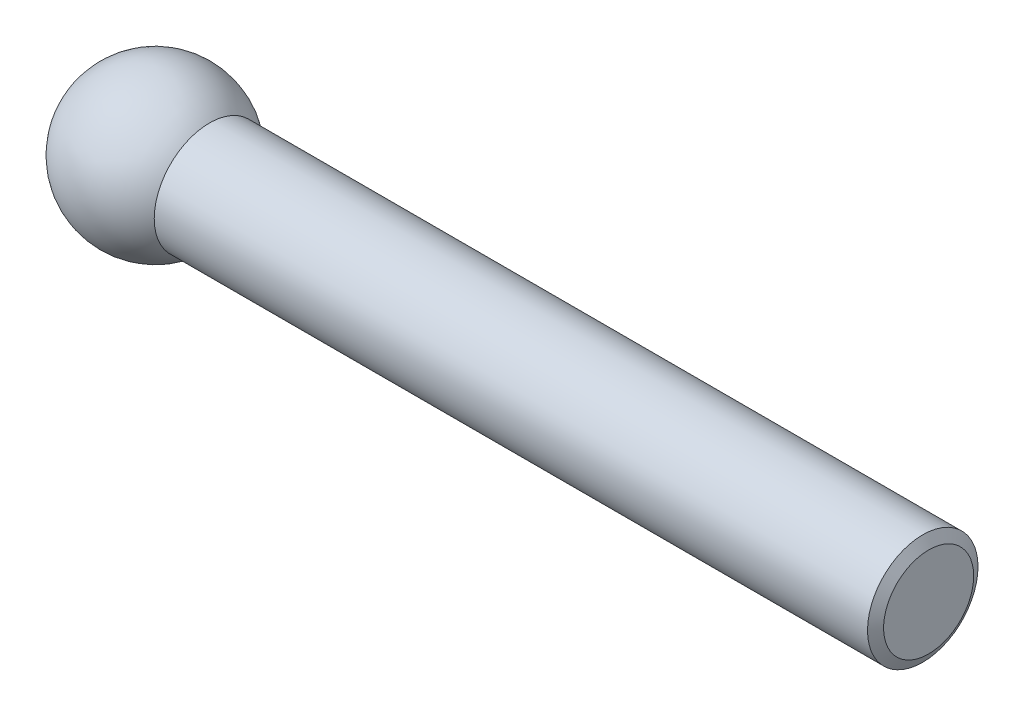
from build123d import *

# Parameters (mm, degrees)
SKETCH1_R           = 14.2875
BOSS_EXTRUDE1_DEPTH = 200
CHAMFER1_SIZE       = 1.524
CHAMFER1_SIZE2      = 2.639645431


with BuildPart() as part:
    # Sketch1 → Boss-Extrude1 (new body)
    with BuildSketch(Plane(origin=(0, 0, 0), x_dir=(0, 0, -1), z_dir=(1, 0, 0))):
        Circle(SKETCH1_R)
    extrude(amount=BOSS_EXTRUDE1_DEPTH)

    # Chamfer1
    chamfer1_edges = [part.edges().sort_by_distance(p)[0] for p in [
        (200, 0, 14.2875),
    ]]
    chamfer1_side = [part.faces().sort_by_distance(p)[0] for p in [
        (100, 0, 14.2875),
    ]]
    chamfer(chamfer1_edges, length=CHAMFER1_SIZE, length2=CHAMFER1_SIZE2, reference=chamfer1_side[0])

    # Sketch4 → Revolve1 (revolve)
    with BuildSketch(Plane.XY):
        with BuildLine():
            Line((-20, 0), (20, 0))
            ThreePointArc((20, 0), (0, 20), (-20, 0))
        make_face()
    revolve(axis=Axis((0, 0, 0), (1, 0, 0)))


solid = part.part
